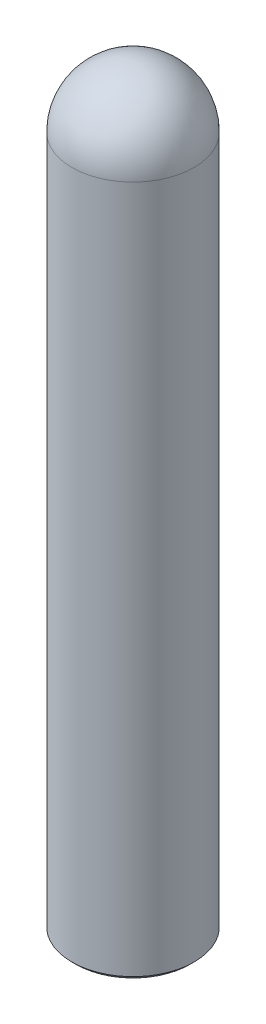
from build123d import *

# Parameters (mm, degrees)
SKETCH1_R           = 15
BOSS_EXTRUDE1_DEPTH = 185
FILLET1_R           = 15
SKETCH2_R           = 3.175
CUT_EXTRUDE1_DEPTH  = 12
CHAMFER1_SIZE       = 0.4
CHAMFER2_SIZE       = 1


with BuildPart() as part:
    # Sketch1 → Boss-Extrude1 (new body)
    with BuildSketch(Plane(origin=(0, 0, 0), x_dir=(1, 0, 0), z_dir=(0, 1, 0))):
        with Locations(Location((0, 0, 0), (0, 0, 270))):
            Circle(SKETCH1_R)
    extrude(amount=BOSS_EXTRUDE1_DEPTH)

    # Fillet1
    fillet1_edges = [part.edges().sort_by_distance(p)[0] for p in [
        (0, 185, -15),
    ]]
    fillet(fillet1_edges, radius=FILLET1_R)

    # Sketch2 → Cut-Extrude1 (cut)
    with BuildSketch(Plane.XZ):
        with Locations(Location((0, 0, 0), (0, 0, 270))):
            Circle(SKETCH2_R)
    extrude(amount=-CUT_EXTRUDE1_DEPTH, mode=Mode.SUBTRACT)

    # Chamfer1
    chamfer1_edges = [part.edges().sort_by_distance(p)[0] for p in [
        (0, 0, 3.175),
    ]]
    chamfer(chamfer1_edges, length=CHAMFER1_SIZE)

    # Chamfer2
    chamfer2_edges = [part.edges().sort_by_distance(p)[0] for p in [
        (0, 0, -15),
    ]]
    chamfer(chamfer2_edges, length=CHAMFER2_SIZE)


solid = part.part
